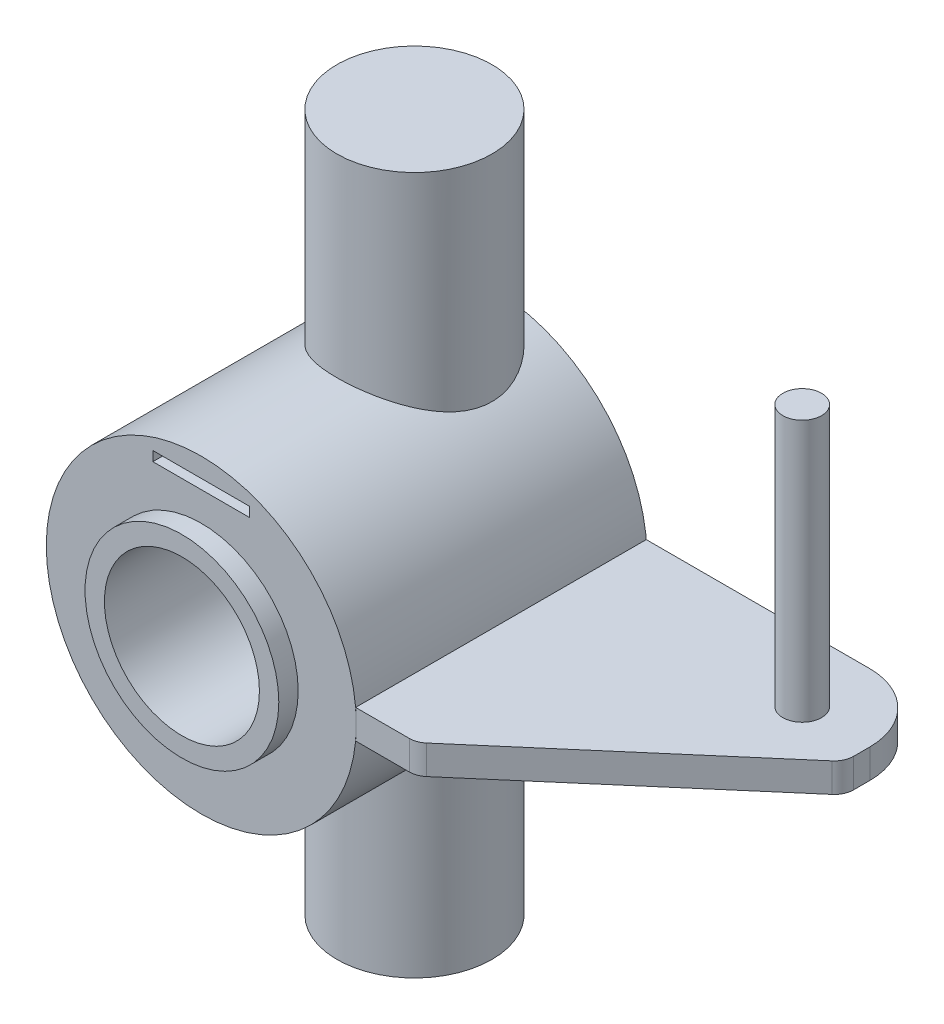
from build123d import *

# Parameters (mm, degrees)
SKETCH1_R                            = 8
BOSS_EXTRUDE1_DEPTH                  = 15
SKETCH2_R                            = 5
SKETCH2_R_2                          = 4
BOSS_EXTRUDE2_DEPTH                  = 1
CUT_EXTRUDE1_START                   = -15
SKETCH3_R                            = 4
CUT_EXTRUDE1_DEPTH                   = 15
SKETCH4_R                            = 4
BOSS_EXTRUDE3_DEPTH                  = 10
BOSS_EXTRUDE3_DIRECTION_2_REACH      = 26
BOSS_EXTRUDE3_DIRECTION_2_END_RADIUS = 8
SKETCH6_R                            = 4
BOSS_EXTRUDE4_DEPTH                  = 10
BOSS_EXTRUDE4_DIRECTION_2_REACH      = 33.559
BOSS_EXTRUDE4_DIRECTION_2_END_RADIUS = 8
SKETCH7_W                            = 15
SKETCH7_H                            = 1.5
BOSS_EXTRUDE5_DEPTH                  = 15
BOSS_EXTRUDE5_DIRECTION_2_REACH      = 30.914
BOSS_EXTRUDE5_DIRECTION_2_END_RADIUS = 8
CUT_EXTRUDE2_DEPTH                   = 15
CUT_EXTRUDE3_DEPTH                   = 15
FILLET1_R                            = 1
FILLET2_R                            = 1
SKETCH12_R                           = 1
BOSS_EXTRUDE6_DEPTH                  = 15
SKETCH14_W                           = 5
SKETCH14_H                           = 0.5
CUT_EXTRUDE4_DEPTH                   = 1


with BuildPart() as part:
    # Sketch1 → Boss-Extrude1 (new body)
    with BuildSketch(Plane.XY):
        Circle(SKETCH1_R)
    extrude(amount=BOSS_EXTRUDE1_DEPTH)

    # Sketch2 → Boss-Extrude2 (add)
    with BuildSketch(Plane.XY.offset(15)):
        Circle(SKETCH2_R)
        Circle(SKETCH2_R_2, mode=Mode.SUBTRACT)
    extrude(amount=BOSS_EXTRUDE2_DEPTH)

    # Sketch3 → Cut-Extrude1 (cut)
    with BuildSketch(Plane.XY.offset(15).offset(CUT_EXTRUDE1_START)):
        Circle(SKETCH3_R)
    extrude(amount=CUT_EXTRUDE1_DEPTH, mode=Mode.SUBTRACT)

    # Sketch6 → Boss-Extrude4 (add)
    with BuildSketch(Plane(origin=(0, -8, 0), x_dir=(-1, 0, 0), z_dir=(0, -1, 0))):
        with Locations(Location((0, -4, 0), (0, 0, 270))):
            Circle(SKETCH6_R)
    extrude(amount=BOSS_EXTRUDE4_DEPTH)

    # Boss-Extrude4 direction 2: up to this cylinder (the profile starts outside it)
    boss_extrude4_direction_2_end = Plane(origin=(0, 0, 4), z_dir=(0, 0, -1)) * Cylinder(BOSS_EXTRUDE4_DIRECTION_2_END_RADIUS, 84.118, mode=Mode.PRIVATE)
    # Sketch6 → Boss-Extrude4 direction 2 (add, up to the surface)
    with BuildSketch(Plane(origin=(0, -8, 0), x_dir=(-1, 0, 0), z_dir=(0, -1, 0)), mode=Mode.PRIVATE) as boss_extrude4_direction_2_sk1:
        with Locations(Location((0, -4, 0), (0, 0, 270))):
            Circle(SKETCH6_R)
    boss_extrude4_direction_2_tool1 = extrude(boss_extrude4_direction_2_sk1.sketch, amount=-BOSS_EXTRUDE4_DIRECTION_2_REACH, mode=Mode.PRIVATE) - boss_extrude4_direction_2_end
    add(boss_extrude4_direction_2_tool1.solids().sort_by_distance((0, -8, 4))[0])
    add(boss_extrude4_direction_2_tool1.solids().sort_by_distance((0, -8, 4))[1])

    # Sketch14 → Cut-Extrude4 (cut)
    with BuildSketch(Plane.XY.offset(15)):
        with Locations((0, 6.75)):
            Rectangle(SKETCH14_W, SKETCH14_H)
    extrude(amount=-CUT_EXTRUDE4_DEPTH, mode=Mode.SUBTRACT)


with BuildPart() as body_2:
    # Sketch4 → Boss-Extrude3 (new body)
    with BuildSketch(Plane(origin=(0, 8, 0), x_dir=(1, 0, 0), z_dir=(0, 1, 0))):
        with Locations(Location((0, -4, 0), (0, 0, 270))):
            Circle(SKETCH4_R)
    extrude(amount=BOSS_EXTRUDE3_DEPTH)

    # Boss-Extrude3 direction 2: up to this cylinder (the profile starts outside it)
    boss_extrude3_direction_2_end = Plane(origin=(0, 0, 4), z_dir=(0, 0, -1)) * Cylinder(BOSS_EXTRUDE3_DIRECTION_2_END_RADIUS, 69, mode=Mode.PRIVATE)
    # Sketch4 → Boss-Extrude3 direction 2 (add, up to the surface)
    with BuildSketch(Plane(origin=(0, 8, 0), x_dir=(1, 0, 0), z_dir=(0, 1, 0)), mode=Mode.PRIVATE) as boss_extrude3_direction_2_sk1:
        with Locations(Location((0, -4, 0), (0, 0, 270))):
            Circle(SKETCH4_R)
    boss_extrude3_direction_2_tool1 = extrude(boss_extrude3_direction_2_sk1.sketch, amount=-BOSS_EXTRUDE3_DIRECTION_2_REACH, mode=Mode.PRIVATE) - boss_extrude3_direction_2_end
    add(boss_extrude3_direction_2_tool1.solids().sort_by_distance((0, 8, 4))[0])
    add(boss_extrude3_direction_2_tool1.solids().sort_by_distance((0, 8, 4))[1])


with BuildPart() as body_3:
    # Sketch7 → Boss-Extrude5 (new body)
    with BuildSketch(Plane(origin=(8, 0, 0), x_dir=(0, 0, -1), z_dir=(1, 0, 0))):
        with Locations((-7.5, 0)):
            Rectangle(SKETCH7_W, SKETCH7_H)
    extrude(amount=BOSS_EXTRUDE5_DEPTH)

    # Boss-Extrude5 direction 2: up to this cylinder (the profile starts outside it)
    boss_extrude5_direction_2_end = Plane(origin=(0, 0, 7.5), z_dir=(0, 0, -1)) * Cylinder(BOSS_EXTRUDE5_DIRECTION_2_END_RADIUS, 78.828, mode=Mode.PRIVATE)
    # Sketch7 → Boss-Extrude5 direction 2 (add, up to the surface)
    with BuildSketch(Plane(origin=(8, 0, 0), x_dir=(0, 0, -1), z_dir=(1, 0, 0)), mode=Mode.PRIVATE) as boss_extrude5_direction_2_sk1:
        with Locations((-7.5, 0)):
            Rectangle(SKETCH7_W, SKETCH7_H)
    boss_extrude5_direction_2_tool1 = extrude(boss_extrude5_direction_2_sk1.sketch, amount=-BOSS_EXTRUDE5_DIRECTION_2_REACH, mode=Mode.PRIVATE) - boss_extrude5_direction_2_end
    add(boss_extrude5_direction_2_tool1.solids().sort_by_distance((8, 0, 7.5))[0])
    add(boss_extrude5_direction_2_tool1.solids().sort_by_distance((8, 0, 7.5))[1])

    # Sketch9 → Cut-Extrude2 (cut)
    with BuildSketch(Plane.XZ.offset(0.75)):
        with BuildLine():
            ThreePointArc((23, 3.5), (21.974873734, 1.025126266), (19.5, 0))
            Line((19.5, 0), (23, 0))
            Line((23, 0), (23, 3.5))
        make_face()
    extrude(amount=-CUT_EXTRUDE2_DEPTH, mode=Mode.SUBTRACT)

    # Sketch11 → Cut-Extrude3 (cut)
    with BuildSketch(Plane(origin=(0, -0.75, 0), x_dir=(-1, 0, 0), z_dir=(0, -1, 0))):
        Polygon((-23, -15), (-11.108053079, -15), (-23, -4.792841708), align=None)
    extrude(amount=-CUT_EXTRUDE3_DEPTH, mode=Mode.SUBTRACT)

    # Fillet1
    fillet1_edges = [body_3.edges().sort_by_distance(p)[0] for p in [
        (11.108053079, 0, 15),
    ]]
    fillet(fillet1_edges, radius=FILLET1_R)

    # Fillet2
    fillet2_edges = [body_3.edges().sort_by_distance(p)[0] for p in [
        (23, 0, 4.792841708),
    ]]
    fillet(fillet2_edges, radius=FILLET2_R)

    # Sketch12 → Boss-Extrude6 (add)
    with BuildSketch(Plane.XZ.offset(0.75)):
        with Locations(Location((19.446318933, 3.434994956, 0), (0, 0, 270))):
            Circle(SKETCH12_R)
    extrude(amount=-BOSS_EXTRUDE6_DEPTH)


solid = Compound([part.part, body_2.part, body_3.part])
